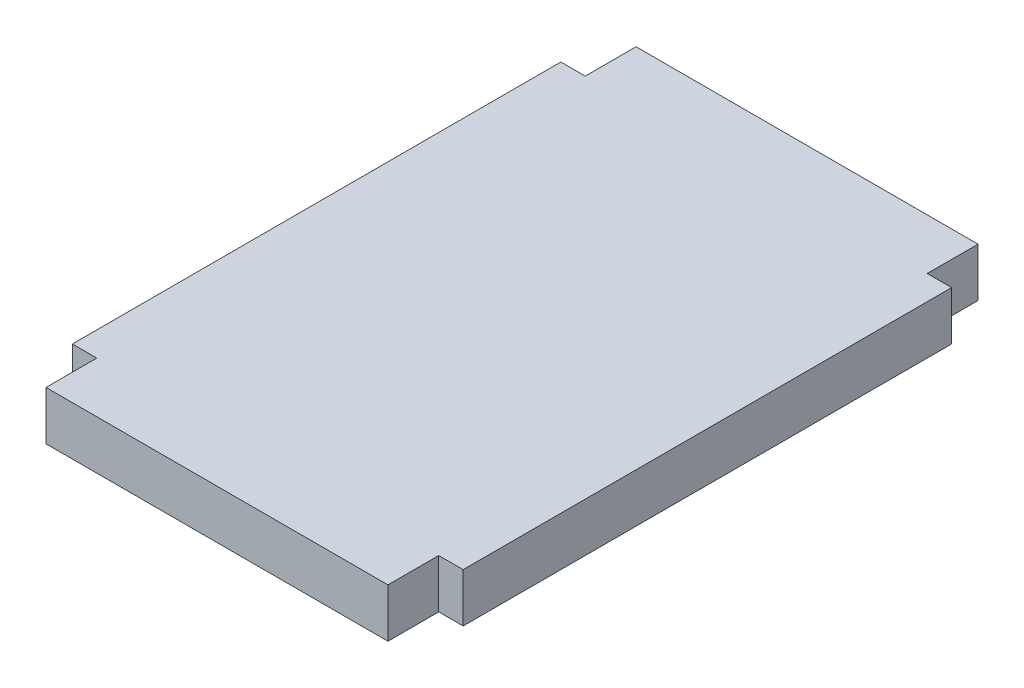
from build123d import *

# Parameters (mm, degrees)
BOSS_EXTRUDE1_DEPTH = 6.35


with BuildPart() as part:
    # Sketch2 → Boss-Extrude1 (new body)
    with BuildSketch(Plane(origin=(0, 0, 0), x_dir=(1, 0, 0), z_dir=(0, 1, 0))):
        Polygon((-22.225, 31.75), (-22.225, 38.354), (22.225, 38.354), (22.225, 31.75), (25.4, 31.75), (25.4, -31.75), (22.225, -31.75), (22.225, -38.354), (-22.225, -38.354), (-22.225, -31.75), (-25.4, -31.75), (-25.4, 31.75), align=None)
    extrude(amount=BOSS_EXTRUDE1_DEPTH)


solid = part.part
